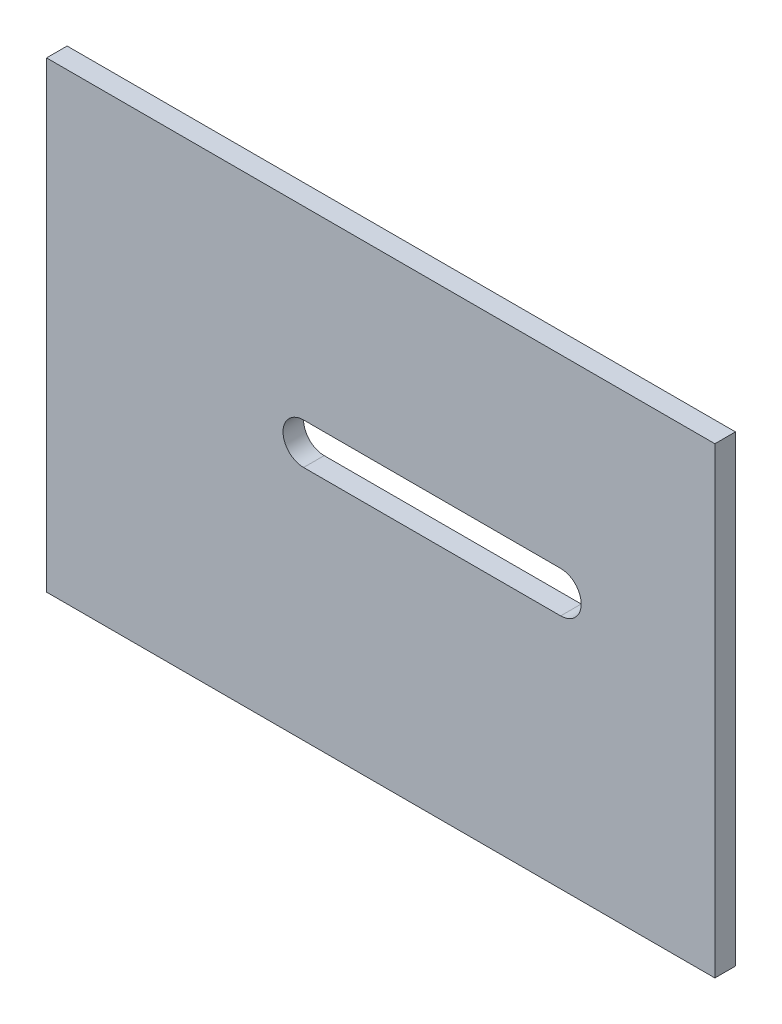
from build123d import *

# Parameters (mm, degrees)
SKETCH1_W           = 65
SKETCH1_H           = 45
BOSS_EXTRUDE1_DEPTH = 2
CUT_EXTRUDE2_DEPTH  = 2


with BuildPart() as part:
    # Sketch1 → Boss-Extrude1 (new body)
    with BuildSketch(Plane.XY):
        Rectangle(SKETCH1_W, SKETCH1_H)
    extrude(amount=BOSS_EXTRUDE1_DEPTH)

    # Sketch2 → Cut-Extrude2 (cut)
    with BuildSketch(Plane.XY):
        with BuildLine():
            Line((-7.5, 4.5), (17.5, 4.5))
            ThreePointArc((17.5, 4.5), (19.5, 2.5), (17.5, 0.5))
            Line((17.5, 0.5), (-7.5, 0.5))
            ThreePointArc((-7.5, 0.5), (-9.5, 2.5), (-7.5, 4.5))
        make_face()
    extrude(amount=CUT_EXTRUDE2_DEPTH, mode=Mode.SUBTRACT)


solid = part.part
